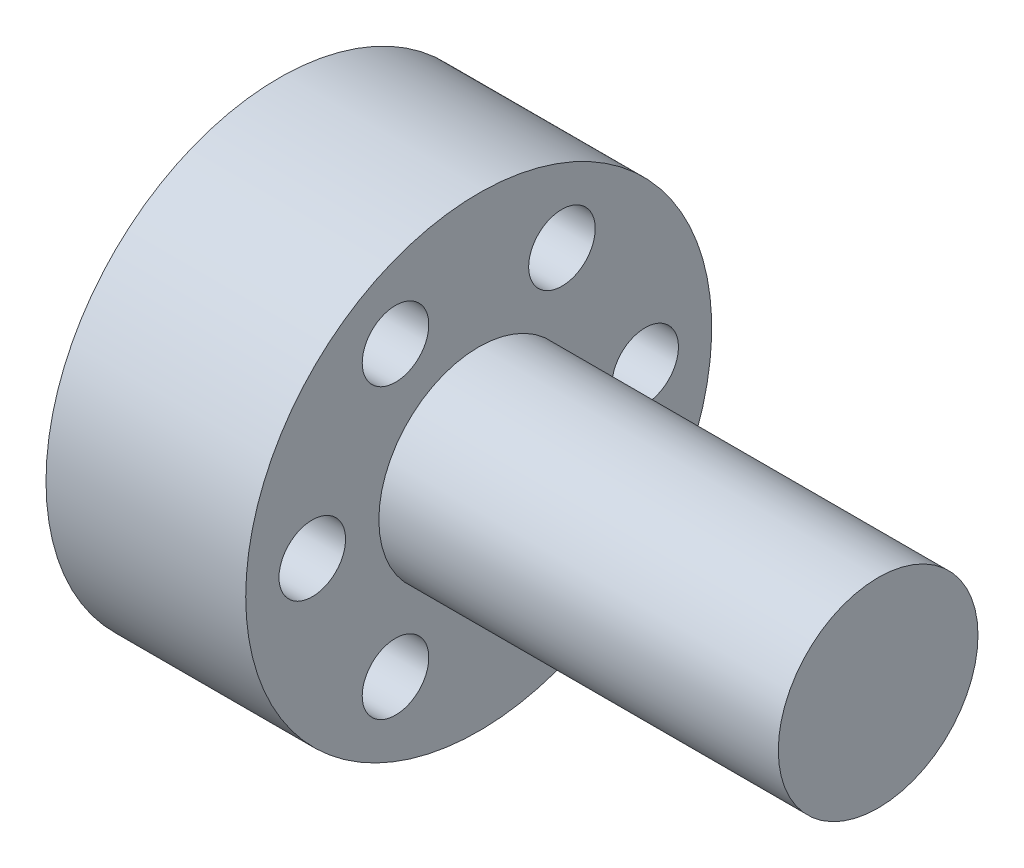
from build123d import *

# Parameters (mm, degrees)
SKETCH_2_R          = 5
CUT_EXTRUDE_1_DEPTH = 112.579568022
SKETCH_3_R          = 5
CUT_EXTRUDE_2_DEPTH = 112.579568022
SKETCH_4_R          = 5
CUT_EXTRUDE_3_DEPTH = 112.579568022
SKETCH_5_R          = 5
CUT_EXTRUDE_4_DEPTH = 112.579568022
SKETCH_6_R          = 5
CUT_EXTRUDE_5_DEPTH = 112.579568022
SKETCH_7_R          = 5
CUT_EXTRUDE_6_DEPTH = 112.579568022


with BuildPart() as part:
    # Эскиз1 → Повернуть1 (revolve)
    with BuildSketch(Plane.XY, mode=Mode.PRIVATE) as revolve_1_sk:
        Polygon((0, 0), (100, 0), (100, 15), (40, 15), (40, 35), (10, 35), (10, 20), (0, 20), align=None)
    revolve(revolve_1_sk.sketch.rotate(Axis((0, 0, 0), (1, 0, 0)), 90), axis=Axis((0, 0, 0), (1, 0, 0)))

    # Эскиз2 → Вырез-Вытянуть1 (cut, through all)
    with BuildSketch(Plane(origin=(0, 0, 0), x_dir=(0, 0, -1), z_dir=(1, 0, 0))):
        with Locations(Location((25, 0, 0), (0, 0, 180))):
            Circle(SKETCH_2_R)
    extrude(amount=CUT_EXTRUDE_1_DEPTH, mode=Mode.SUBTRACT)

    # Эскиз3 → Вырез-Вытянуть2 (cut, through all)
    with BuildSketch(Plane(origin=(0, 0, 0), x_dir=(0, 0, -1), z_dir=(1, 0, 0))):
        with Locations(Location((12.5, 21.650635095, 0), (0, 0, 180))):
            Circle(SKETCH_3_R)
    extrude(amount=CUT_EXTRUDE_2_DEPTH, mode=Mode.SUBTRACT)

    # Эскиз4 → Вырез-Вытянуть3 (cut, through all)
    with BuildSketch(Plane(origin=(0, 0, 0), x_dir=(0, 0, -1), z_dir=(1, 0, 0))):
        with Locations(Location((-12.5, 21.650635095, 0), (0, 0, 180))):
            Circle(SKETCH_4_R)
    extrude(amount=CUT_EXTRUDE_3_DEPTH, mode=Mode.SUBTRACT)

    # Эскиз5 → Вырез-Вытянуть4 (cut, through all)
    with BuildSketch(Plane(origin=(0, 0, 0), x_dir=(0, 0, -1), z_dir=(1, 0, 0))):
        with Locations(Location((-25, 0, 0), (0, 0, 180))):
            Circle(SKETCH_5_R)
    extrude(amount=CUT_EXTRUDE_4_DEPTH, mode=Mode.SUBTRACT)

    # Эскиз6 → Вырез-Вытянуть5 (cut, through all)
    with BuildSketch(Plane(origin=(0, 0, 0), x_dir=(0, 0, -1), z_dir=(1, 0, 0))):
        with Locations(Location((-12.5, -21.650635095, 0), (0, 0, 180))):
            Circle(SKETCH_6_R)
    extrude(amount=CUT_EXTRUDE_5_DEPTH, mode=Mode.SUBTRACT)

    # Эскиз7 → Вырез-Вытянуть6 (cut, through all)
    with BuildSketch(Plane(origin=(0, 0, 0), x_dir=(0, 0, -1), z_dir=(1, 0, 0))):
        with Locations(Location((12.5, -21.650635095, 0), (0, 0, 180))):
            Circle(SKETCH_7_R)
    extrude(amount=CUT_EXTRUDE_6_DEPTH, mode=Mode.SUBTRACT)


solid = part.part
